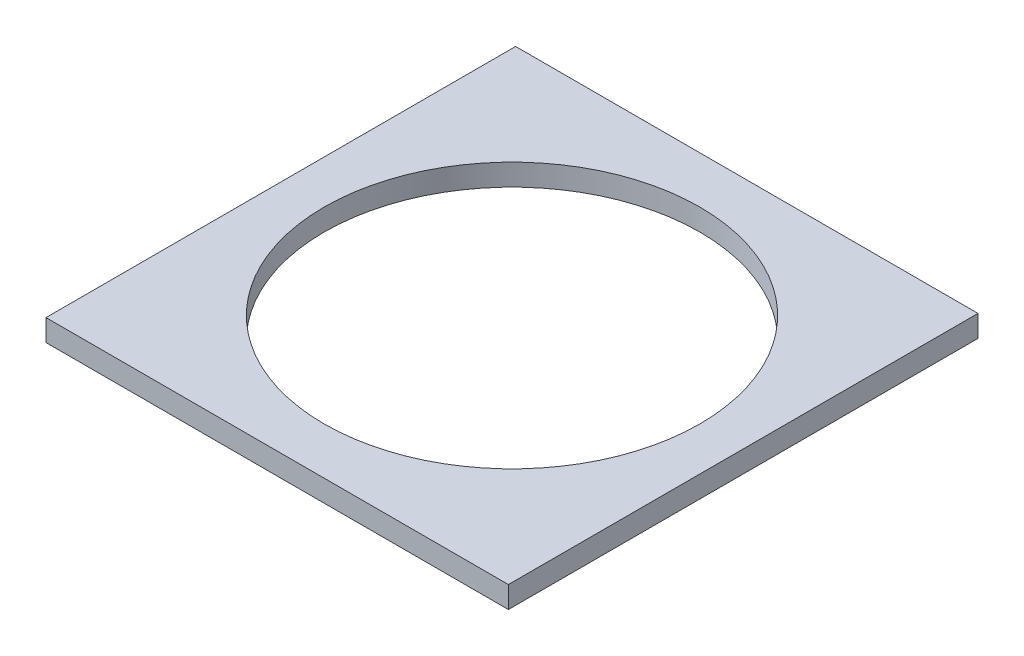
from build123d import *

# Parameters (mm, degrees)
SKETCH4_W           = 64
SKETCH4_H           = 64.999999965
SKETCH4_R           = 26
BOSS_EXTRUDE2_DEPTH = 3


with BuildPart() as part:
    # Sketch4 → Boss-Extrude2 (new body)
    with BuildSketch(Plane(origin=(0, 0, 0), x_dir=(1, 0, 0), z_dir=(0, 1, 0))):
        with Locations((-26.675923108, 1.812817691)):
            Rectangle(SKETCH4_W, SKETCH4_H)
        with Locations(Location((-26.675923108, 1.812817562, 0), (0, 0, 270))):
            Circle(SKETCH4_R, mode=Mode.SUBTRACT)
    extrude(amount=BOSS_EXTRUDE2_DEPTH)


solid = part.part
